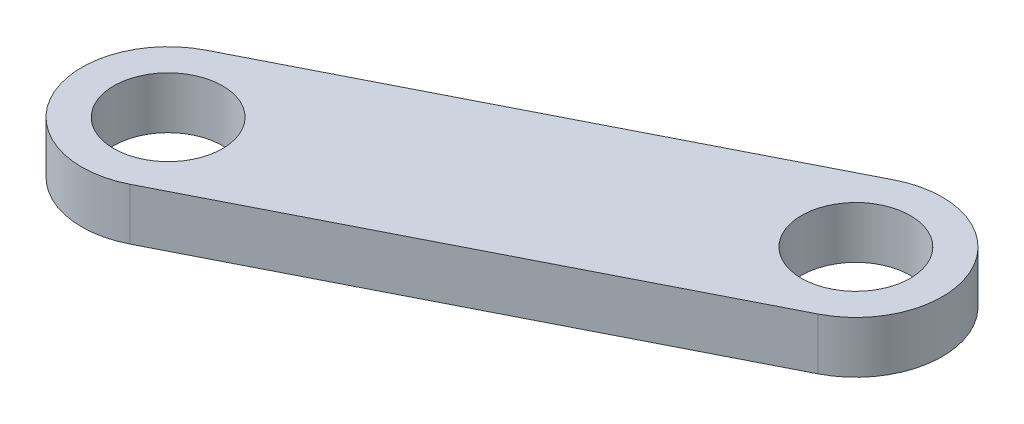
from build123d import *

# Parameters (mm, degrees)
SKETCH1_R           = 2
BOSS_EXTRUDE1_DEPTH = 1.905


with BuildPart() as part:
    # Sketch1 → Boss-Extrude1 (new body)
    with BuildSketch(Plane(origin=(0, 0, 0), x_dir=(1, 0, 0), z_dir=(0, 1, 0))):
        with BuildLine():
            Line((1.437035884, -2.831175174), (-15.326964116, -11.340175174))
            ThreePointArc((-15.326964116, -11.340175174), (-19.595175174, -9.946035884), (-18.201035884, -5.677824826))
            Line((-18.201035884, -5.677824826), (-1.437035884, 2.831175174))
            ThreePointArc((-1.437035884, 2.831175174), (2.831175174, 1.437035884), (1.437035884, -2.831175174))
        make_face()
        with Locations(Location((0, 0, 0), (0, 0, 270))):
            Circle(SKETCH1_R, mode=Mode.SUBTRACT)
        with Locations(Location((-16.764, -8.509, 0), (0, 0, 270))):
            Circle(SKETCH1_R, mode=Mode.SUBTRACT)
    extrude(amount=-BOSS_EXTRUDE1_DEPTH)


solid = part.part
